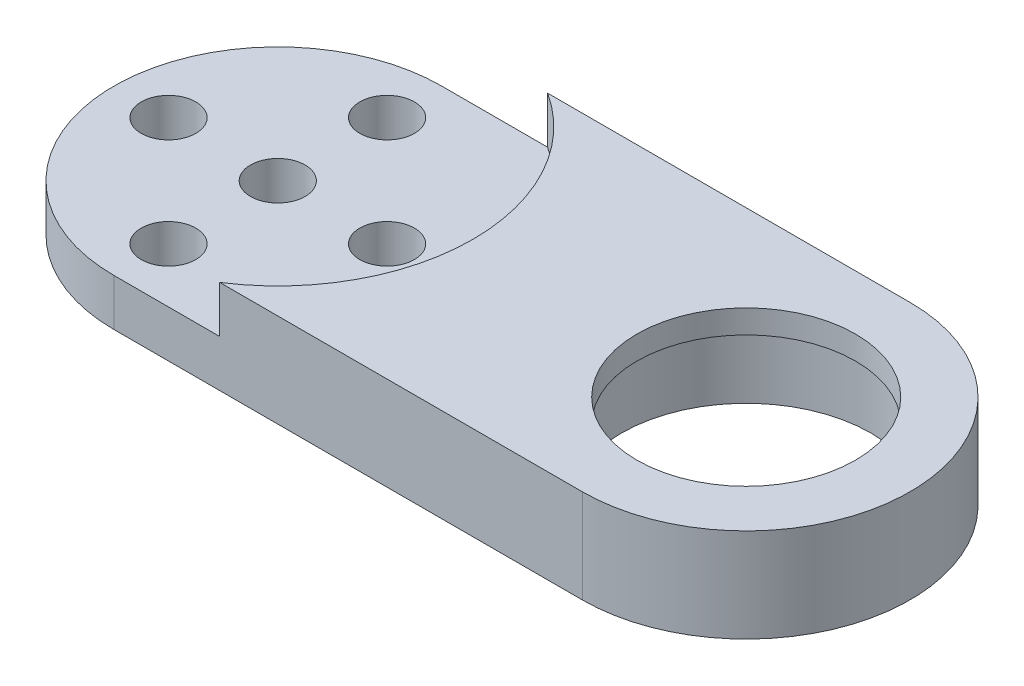
from build123d import *

# Parameters (mm, degrees)
BOSS_EXTRUDE1_DEPTH     = 6
SKETCH4_R               = 1.75
SERVO_HORN_HOLES_DEPTH  = 29.222331583
SKETCH5_R               = 8
BEARING_PRESS_FIT_DEPTH = 4.5
SKETCH7_R               = 12.5
CUT_EXTRUDE1_DEPTH      = 3
SKETCH8_R               = 7
CUT_EXTRUDE2_DEPTH      = 28.941904015


with BuildPart() as part:
    # Sketch2 → Boss-Extrude1 (new body)
    with BuildSketch(Plane(origin=(0, 0, 0), x_dir=(1, 0, 0), z_dir=(0, 1, 0))):
        with BuildLine():
            Line((15, 10.5), (-15, 10.5))
            ThreePointArc((-15, 10.5), (-25.5, 0), (-15, -10.5))
            Line((-15, -10.5), (15, -10.5))
            ThreePointArc((15, -10.5), (25.5, 0), (15, 10.5))
        make_face()
    extrude(amount=BOSS_EXTRUDE1_DEPTH)

    # Sketch4 → Servo horn holes (cut, through all)
    with BuildSketch(Plane(origin=(0, 6, 0), x_dir=(1, 0, 0), z_dir=(0, 1, 0))):
        with Locations(Location((-15, 0, 0), (0, 0, 270))):
            Circle(SKETCH4_R)
        with Locations(Location((-8, 0, 0), (0, 0, 270))):
            Circle(SKETCH4_R)
        with Locations(Location((-15, -7, 0), (0, 0, 270))):
            Circle(SKETCH4_R)
        with Locations(Location((-22, 0, 0), (0, 0, 270))):
            Circle(SKETCH4_R)
        with Locations(Location((-15, 7, 0), (0, 0, 270))):
            Circle(SKETCH4_R)
    extrude(amount=-SERVO_HORN_HOLES_DEPTH, mode=Mode.SUBTRACT)

    # Sketch5 → Bearing press fit (cut)
    with BuildSketch(Plane(origin=(0, 0, 0), x_dir=(-1, 0, 0), z_dir=(0, -1, 0))):
        with Locations(Location((-15, 0, 0), (0, 0, 90))):
            Circle(SKETCH5_R)
    extrude(amount=-BEARING_PRESS_FIT_DEPTH, mode=Mode.SUBTRACT)

    # Sketch7 → Cut-Extrude1 (cut)
    with BuildSketch(Plane(origin=(0, 6, 0), x_dir=(1, 0, 0), z_dir=(0, 1, 0))):
        with Locations((-15, 0)):
            Circle(SKETCH7_R)
    extrude(amount=-CUT_EXTRUDE1_DEPTH, mode=Mode.SUBTRACT)

    # Sketch8 → Cut-Extrude2 (cut, through all)
    with BuildSketch(Plane.XZ.offset(-4.5)):
        with Locations(Location((15, 0, 0), (0, 0, 270))):
            Circle(SKETCH8_R)
    extrude(amount=-CUT_EXTRUDE2_DEPTH, mode=Mode.SUBTRACT)


solid = part.part
